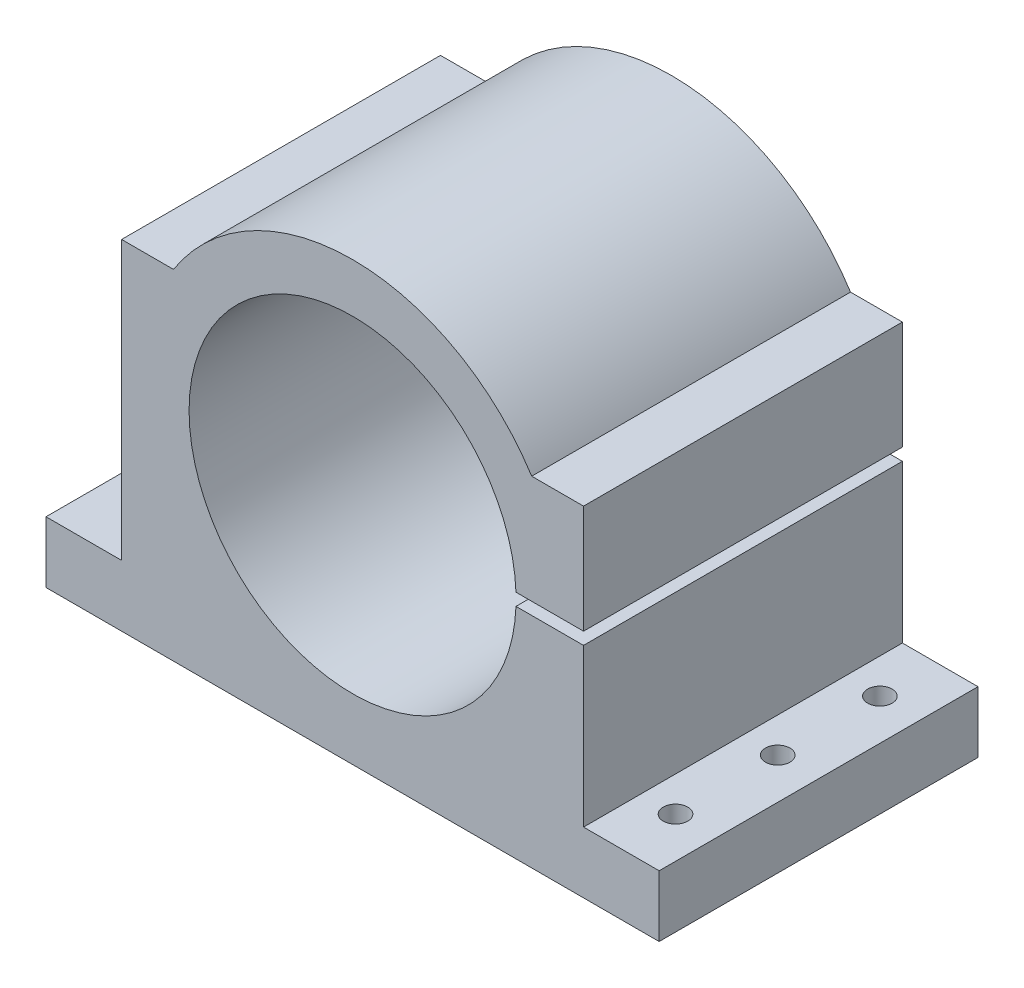
from build123d import *

# Parameters (mm, degrees)
ESQUISSE1_R             = 40
BOSS_EXTRU_1_DEPTH      = 78
ESQUISSE2_W             = 36.5
ESQUISSE2_H             = 3
ENL_V_MAT_EXTRU_1_DEPTH = 78
ESQUISSE3_R             = 3
ENL_V_MAT_EXTRU_2_DEPTH = 15


with BuildPart() as part:
    # Esquisse1 → Boss.-Extru.1 (new body)
    with BuildSketch(Plane.XY):
        with BuildLine():
            Line((-75, 0), (75, 0))
            Line((75, 0), (75, 15))
            Line((75, 15), (56.5, 15))
            Line((56.5, 15), (56.5, 83))
            Line((56.5, 83), (43.8178046, 83))
            ThreePointArc((43.8178046, 83), (0, 107), (-43.8178046, 83))
            Line((-43.8178046, 83), (-56.5, 83))
            Line((-56.5, 83), (-56.5, 15))
            Line((-56.5, 15), (-75, 15))
            Line((-75, 15), (-75, 0))
        make_face()
        with Locations((0, 55)):
            Circle(ESQUISSE1_R, mode=Mode.SUBTRACT)
    extrude(amount=BOSS_EXTRU_1_DEPTH)

    # Esquisse2 → Enlèv. mat.-Extru.1 (cut)
    with BuildSketch(Plane.XY.offset(78)):
        with Locations((38.25, 55)):
            Rectangle(ESQUISSE2_W, ESQUISSE2_H)
    extrude(amount=-ENL_V_MAT_EXTRU_1_DEPTH, mode=Mode.SUBTRACT)

    # Esquisse3 → Enlèv. mat.-Extru.2 (cut)
    with BuildSketch(Plane(origin=(0, 15, 0), x_dir=(1, 0, 0), z_dir=(0, 1, 0))):
        with Locations(Location((-65, -39, 0), (0, 0, 180))):
            Circle(ESQUISSE3_R)
        with Locations(Location((-65, -14, 0), (0, 0, 180))):
            Circle(ESQUISSE3_R)
        with Locations(Location((-65, -64, 0), (0, 0, 180))):
            Circle(ESQUISSE3_R)
        with Locations(Location((65, -64, 0), (0, 0, 180))):
            Circle(ESQUISSE3_R)
        with Locations(Location((65, -14, 0), (0, 0, 180))):
            Circle(ESQUISSE3_R)
        with Locations(Location((65, -39, 0), (0, 0, 180))):
            Circle(ESQUISSE3_R)
    extrude(amount=-ENL_V_MAT_EXTRU_2_DEPTH, mode=Mode.SUBTRACT)


solid = part.part
